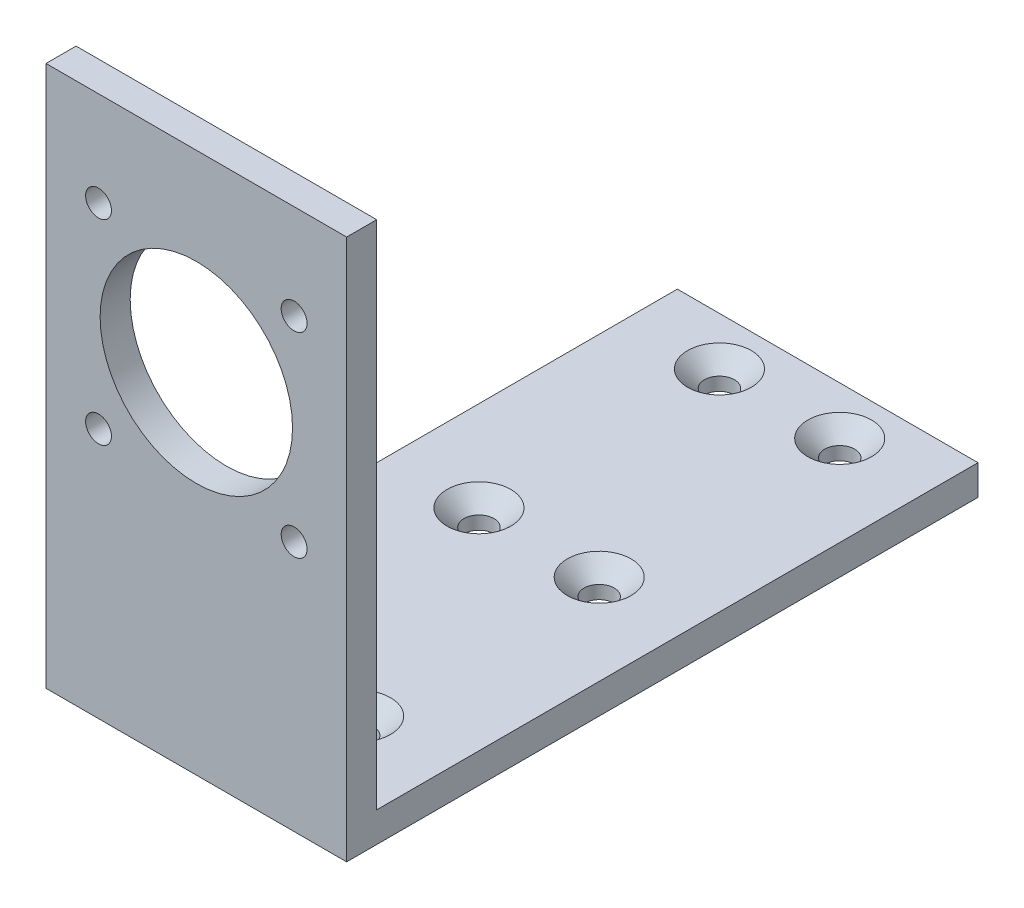
from build123d import *

# Parameters (mm, degrees)
SKETCH2_W           = 50
SKETCH2_H           = 90
SKETCH2_R           = 16
SKETCH2_R_2         = 2.15
BOSS_EXTRUDE1_DEPTH = 5
SKETCH3_W           = 50
SKETCH3_H           = 5
BOSS_EXTRUDE2_DEPTH = 100
SKETCH4_R           = 2.5
CUT_EXTRUDE1_DEPTH  = 134.603892159
CHAMFER1_SIZE       = 2.8


with BuildPart() as part:
    # Sketch2 → Boss-Extrude1 (new body)
    with BuildSketch(Plane.XY):
        Rectangle(SKETCH2_W, SKETCH2_H)
        with Locations((0, 13)):
            Circle(SKETCH2_R, mode=Mode.SUBTRACT)
        with Locations((-16.263455967, 29.263455967)):
            Circle(SKETCH2_R_2, mode=Mode.SUBTRACT)
        with Locations((16.263455967, 29.263455967)):
            Circle(SKETCH2_R_2, mode=Mode.SUBTRACT)
        with Locations((16.263455967, -3.263455967)):
            Circle(SKETCH2_R_2, mode=Mode.SUBTRACT)
        with Locations((-16.263455967, -3.263455967)):
            Circle(SKETCH2_R_2, mode=Mode.SUBTRACT)
    extrude(amount=BOSS_EXTRUDE1_DEPTH)

    # Sketch3 → Boss-Extrude2 (add)
    with BuildSketch(Plane(origin=(0, 0, 0), x_dir=(-1, 0, 0), z_dir=(0, 0, -1))):
        with Locations((0, -42.5)):
            Rectangle(SKETCH3_W, SKETCH3_H)
    extrude(amount=BOSS_EXTRUDE2_DEPTH)

    # Sketch4 → Cut-Extrude1 (cut, through all)
    with BuildSketch(Plane(origin=(0, -40, 0), x_dir=(1, 0, 0), z_dir=(0, 1, 0))):
        with Locations(Location((-10, 92.002293004, 0), (0, 0, 180))):
            Circle(SKETCH4_R)
        with Locations(Location((10, 92.002293004, 0), (0, 0, 180))):
            Circle(SKETCH4_R)
        with Locations(Location((-10, 12.002293004, 0), (0, 0, 180))):
            Circle(SKETCH4_R)
        with Locations(Location((10, 12.002293004, 0), (0, 0, 180))):
            Circle(SKETCH4_R)
        with Locations(Location((-10, 52.002293004, 0), (0, 0, 180))):
            Circle(SKETCH4_R)
        with Locations(Location((10, 52.002293004, 0), (0, 0, 180))):
            Circle(SKETCH4_R)
    extrude(amount=-CUT_EXTRUDE1_DEPTH, mode=Mode.SUBTRACT)

    # Chamfer1
    chamfer1_edges = [part.edges().sort_by_distance(p)[0] for p in [
        (-7.5, -40, -92.002293004),
        (12.5, -40, -92.002293004),
        (-7.5, -40, -12.002293004),
        (12.5, -40, -12.002293004),
        (-7.5, -40, -52.002293004),
        (12.5, -40, -52.002293004),
    ]]
    chamfer(chamfer1_edges, length=CHAMFER1_SIZE)


solid = part.part
